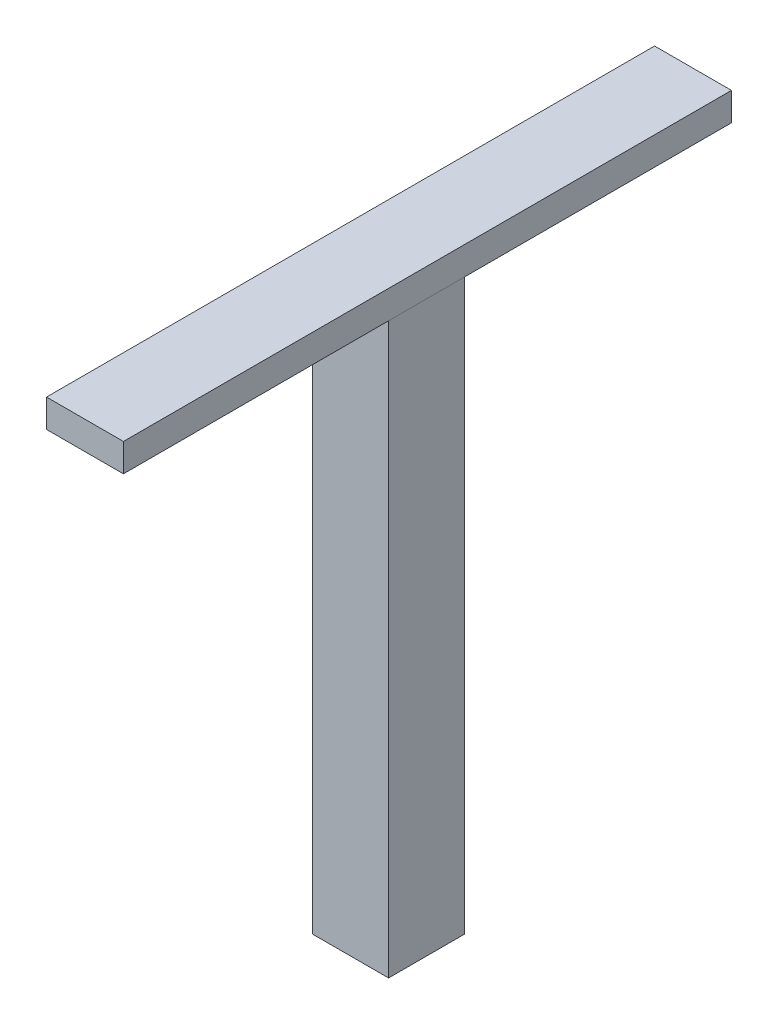
from build123d import *

# Parameters (mm, degrees)
EXTRUDE_1_DEPTH      = 150
EXTRUDE_2_DEPTH      = 70
EXTRUDE_2_DEPTH_BACK = 90
SKETCH_7_W           = 20.232494165
SKETCH_7_H           = 7.389232753


with BuildPart() as part:
    # Sketch 3D_1 → 凸台-拉伸1 (new body)
    with BuildSketch(Plane(origin=(0, 0, 0), x_dir=(0.7071067811865476, 0, 0.7071067811865476), z_dir=(0, 1, 0))):
        Polygon((0, 0), (14.142135624, 14.142135624), (28.284271247, 0), (14.142135624, -14.142135624), align=None)
    extrude(amount=EXTRUDE_1_DEPTH)


with BuildPart() as body_2:
    # 草图7 → 凸台-拉伸2 (new, two sides: drawn at the far end of the back side and taken through both)
    with BuildSketch(Plane.XY.offset(20).offset(-EXTRUDE_2_DEPTH_BACK)):
        with Locations((10.116247083, 153.694616376)):
            Rectangle(SKETCH_7_W, SKETCH_7_H)
    extrude(amount=EXTRUDE_2_DEPTH + EXTRUDE_2_DEPTH_BACK)


solid = Compound([part.part, body_2.part])
